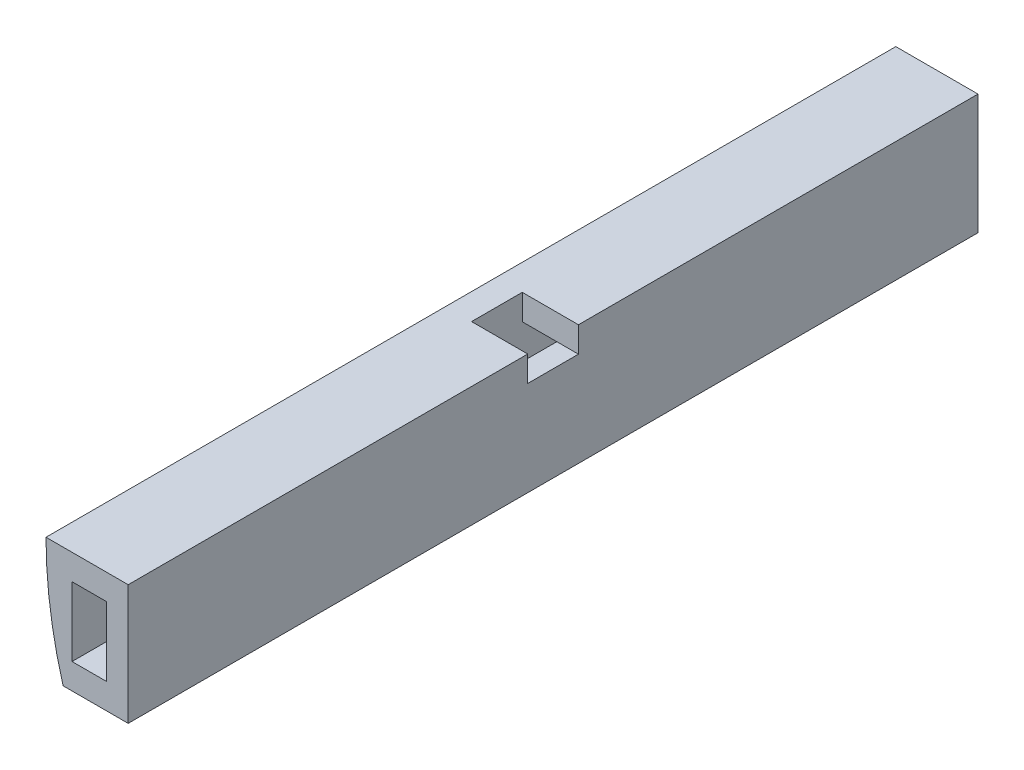
from build123d import *

# Parameters (mm, degrees)
BOSS_EXTRUDE1_DEPTH = 149.86
SKETCH2_W           = 9.906
SKETCH2_H           = 4.4958
BOSS_EXTRUDE2_DEPTH = 70.4596
SKETCH3_W           = 9.906
SKETCH3_H           = 4.4958
BOSS_EXTRUDE3_DEPTH = 70.4596


with BuildPart() as part:
    # Sketch1 → Boss-Extrude1 (new body)
    with BuildSketch(Plane.XY):
        with BuildLine():
            Line((-61.5779714, -4.4958), (-65.3879714, -4.4958))
            Line((-65.3879714, -4.4958), (-65.3879714, -16.6878))
            Line((-65.3879714, -16.6878), (-71.4839714, -16.6878))
            Line((-71.4839714, -16.6878), (-71.4839714, 0))
            Line((-71.4839714, 0), (-76.073, 0))
            ThreePointArc((-76.073, 0), (-75.317007822, -10.698114871), (-73.064056964, -21.1836))
            Line((-73.064056964, -21.1836), (-61.5779714, -21.1836))
            Line((-61.5779714, -21.1836), (-61.5779714, -4.4958))
        make_face()
    extrude(amount=BOSS_EXTRUDE1_DEPTH)

    # Sketch2 → Boss-Extrude2 (add)
    with BuildSketch(Plane.XY.offset(149.86)):
        with Locations((-66.5309714, -2.2479)):
            Rectangle(SKETCH2_W, SKETCH2_H)
    extrude(amount=-BOSS_EXTRUDE2_DEPTH)

    # Sketch3 → Boss-Extrude3 (add)
    with BuildSketch(Plane(origin=(0, 0, 0), x_dir=(-1, 0, 0), z_dir=(0, 0, -1))):
        with Locations((66.5309714, -2.2479)):
            Rectangle(SKETCH3_W, SKETCH3_H)
    extrude(amount=-BOSS_EXTRUDE3_DEPTH)


solid = part.part
